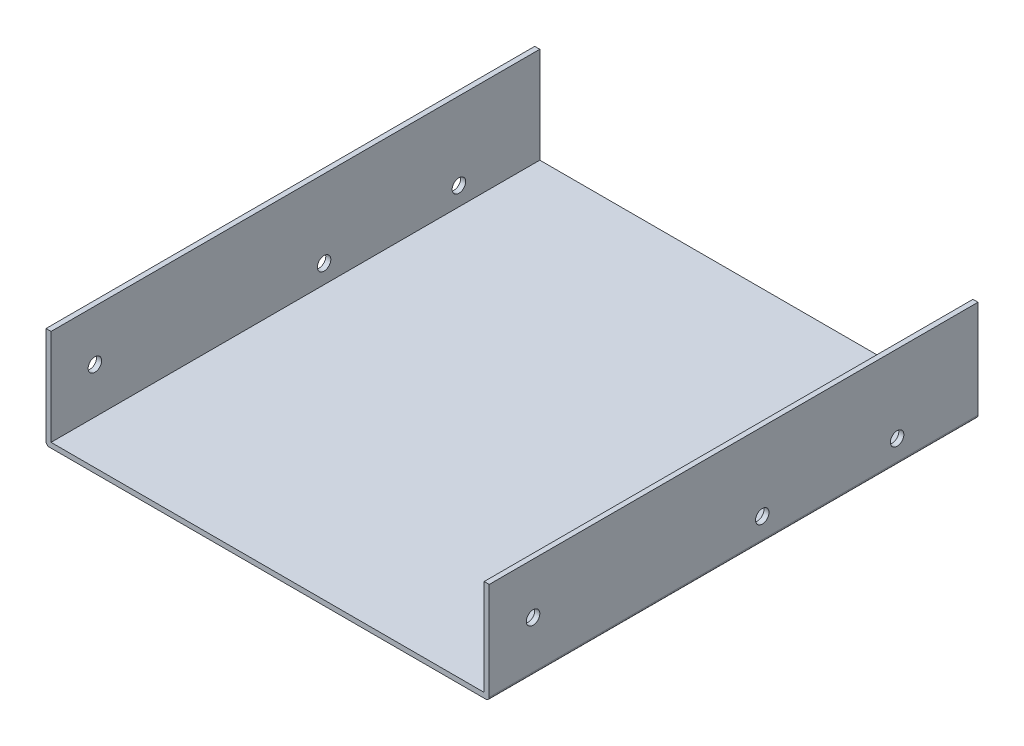
from build123d import *

# Parameters (mm, degrees)
SALIENTE_EXTRUIR1_DEPTH = 72.5
CROQUIS2_R              = 2
CORTAR_EXTRUIR1_DEPTH   = 145


with BuildPart() as part:
    # Croquis1 → Saliente-Extruir1 (new, symmetric)
    with BuildSketch(Plane.XY):
        with BuildLine():
            Line((-64.25, 14.5), (-64.25, -14))
            Line((-64.25, -14), (64.25, -14))
            Line((64.25, -14), (64.25, 14.5))
            Line((64.25, 14.5), (65.75, 14.5))
            Line((65.75, 14.5), (65.75, -14.5))
            ThreePointArc((65.75, -14.5), (65.457106781, -15.207106781), (64.75, -15.5))
            Line((64.75, -15.5), (-64.75, -15.5))
            ThreePointArc((-64.75, -15.5), (-65.457106781, -15.207106781), (-65.75, -14.5))
            Line((-65.75, -14.5), (-65.75, 14.5))
            Line((-65.75, 14.5), (-64.25, 14.5))
        make_face()
    extrude(amount=SALIENTE_EXTRUIR1_DEPTH, both=True)

    # Croquis2 → Cortar-Extruir1 (cut)
    with BuildSketch(Plane(origin=(65.75, 0, 0), x_dir=(0, 0, -1), z_dir=(1, 0, 0))):
        with Locations(Location((-59.5, -0.5, 0), (0, 0, 90))):
            Circle(CROQUIS2_R)
        with Locations(Location((8.5, -8.5, 0), (0, 0, 90))):
            Circle(CROQUIS2_R)
        with Locations(Location((48.5, -8.5, 0), (0, 0, 90))):
            Circle(CROQUIS2_R)
    extrude(amount=-CORTAR_EXTRUIR1_DEPTH, mode=Mode.SUBTRACT)


solid = part.part
